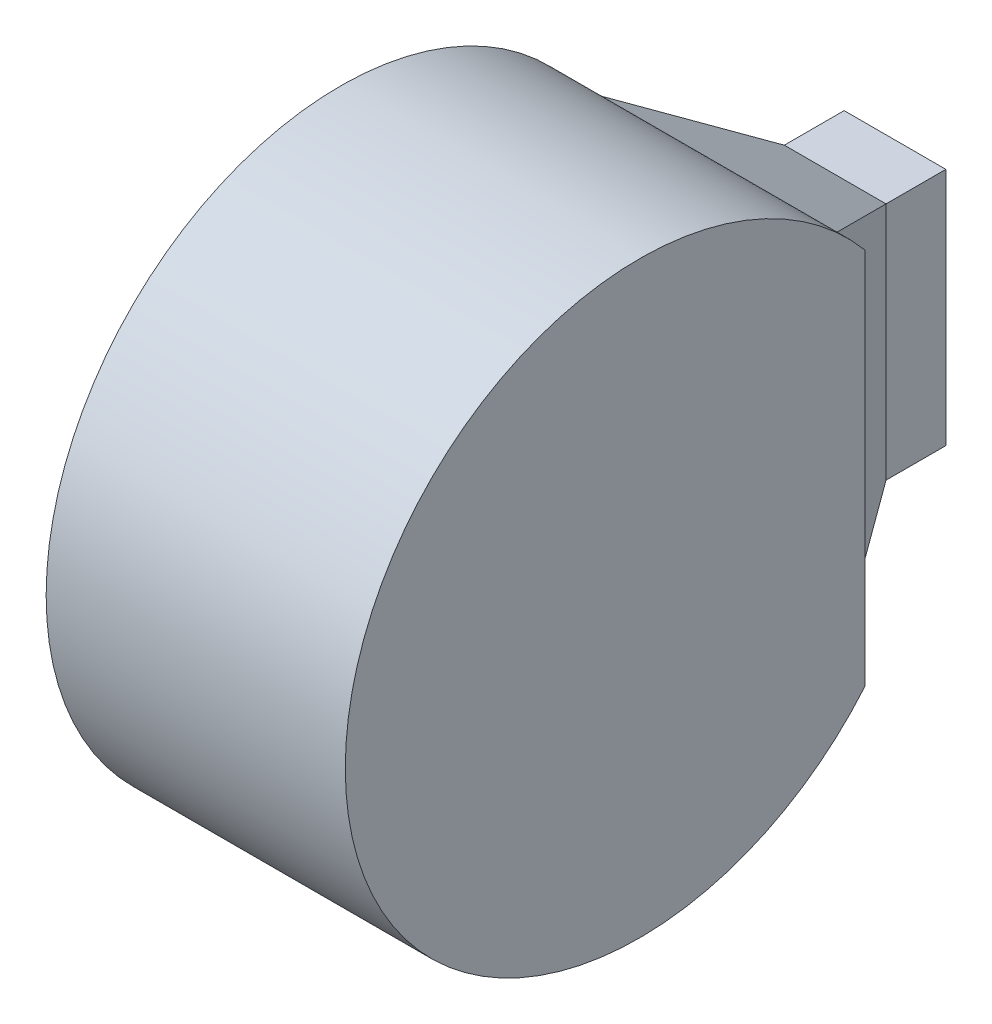
from build123d import *

# Parameters (mm, degrees)
SKETCH_1_W      = 17
SKETCH_1_H      = 40
EXTRUDE_1_DEPTH = 10
SKETCH_2_W      = 17
SKETCH_2_H      = 40
EXTRUDE_2_DEPTH = 20
EXTRUDE_2_TAPER = -30
EXTRUDE_3_DEPTH = 25


with BuildPart() as part:
    # 草图1 → 凸台-拉伸1 (new body)
    with BuildSketch(Plane.XY):
        Rectangle(SKETCH_1_W, SKETCH_1_H)
    extrude(amount=EXTRUDE_1_DEPTH)

    # 草图2 → 凸台-拉伸2 (add)
    with BuildSketch(Plane.XY.offset(10)):
        Rectangle(SKETCH_2_W, SKETCH_2_H)
    extrude(amount=EXTRUDE_2_DEPTH, taper=EXTRUDE_2_TAPER)

    # 草图3 → 凸台-拉伸3 (add, symmetric)
    with BuildSketch(Plane(origin=(0, 0, 0), x_dir=(0, 0, -1), z_dir=(1, 0, 0))):
        with BuildLine():
            Line((-30, 31.547005384), (-30, -31.547005384))
            ThreePointArc((-30, -31.547005384), (-116.885818272, 0), (-30, 31.547005384))
        make_face()
    extrude(amount=EXTRUDE_3_DEPTH, both=True)


solid = part.part
